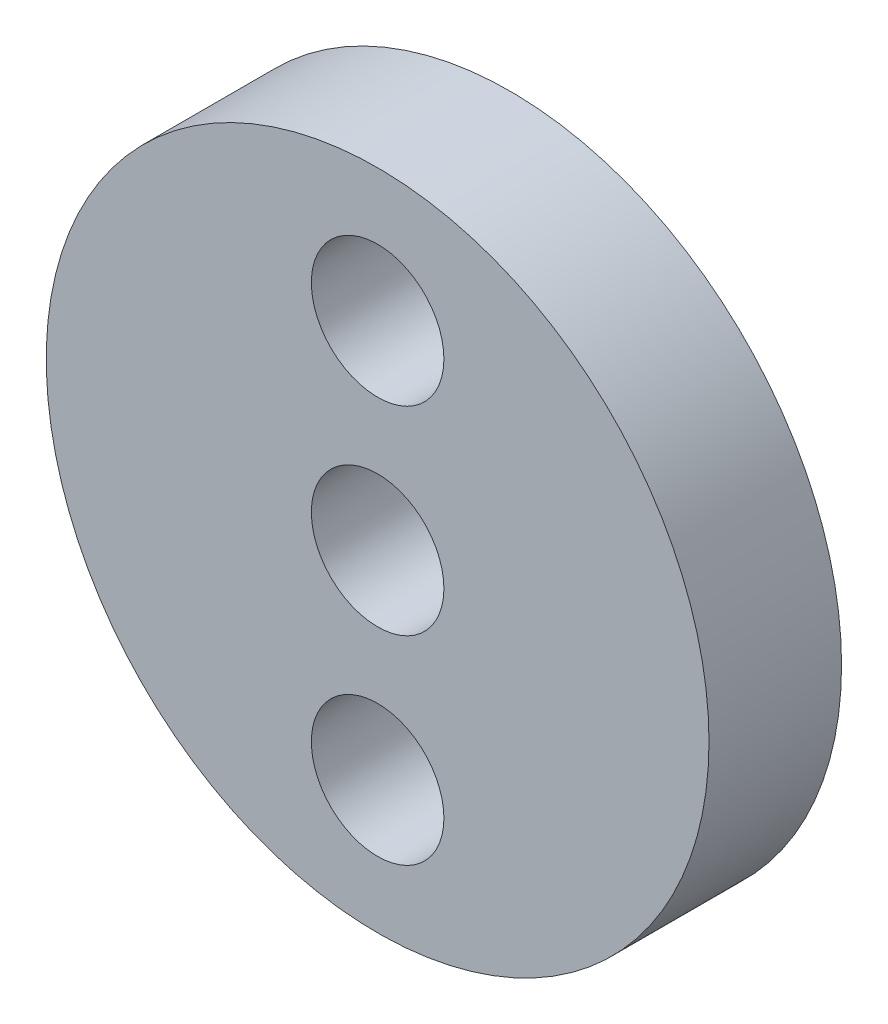
from build123d import *

# Parameters (mm, degrees)
ESBO_O1_R                = 15
ESBO_O1_R_2              = 3
RESSALTO_EXTRUS_O1_DEPTH = 6


with BuildPart() as part:
    # Esboço1 → Ressalto-extrusão1 (new body)
    with BuildSketch(Plane.XY):
        Circle(ESBO_O1_R)
        Circle(ESBO_O1_R_2, mode=Mode.SUBTRACT)
        with Locations((0, 9)):
            Circle(ESBO_O1_R_2, mode=Mode.SUBTRACT)
        with Locations((0, -9)):
            Circle(ESBO_O1_R_2, mode=Mode.SUBTRACT)
    extrude(amount=RESSALTO_EXTRUS_O1_DEPTH)


solid = part.part
